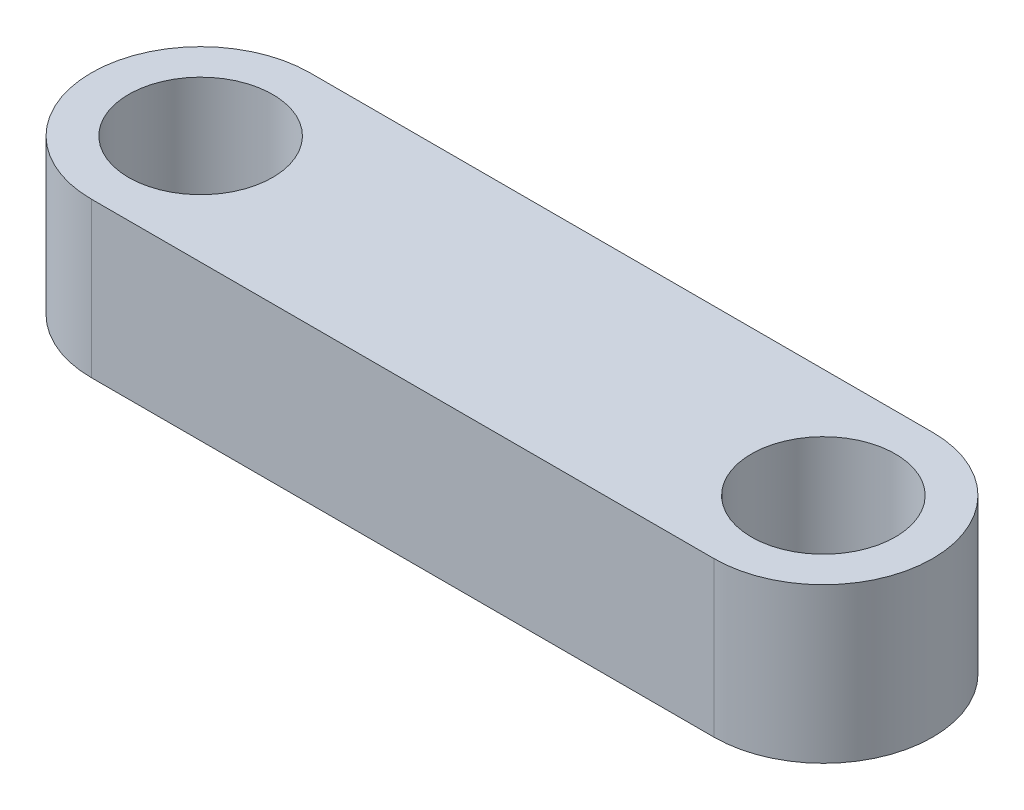
from build123d import *

# Parameters (mm, degrees)
SKETCH1_R           = 2.7
BOSS_EXTRUDE1_DEPTH = 5.8


with BuildPart() as part:
    # Sketch1 → Boss-Extrude1 (new body)
    with BuildSketch(Plane(origin=(0, 0, 0), x_dir=(1, 0, 0), z_dir=(0, 1, 0))):
        with BuildLine():
            Line((-11.675, 4.1), (11.675, 4.1))
            ThreePointArc((11.675, 4.1), (15.775, 0), (11.675, -4.1))
            Line((11.675, -4.1), (-11.675, -4.1))
            ThreePointArc((-11.675, -4.1), (-15.775, 0), (-11.675, 4.1))
        make_face()
        with Locations(Location((-11.675, 0, 0), (0, 0, 270))):
            Circle(SKETCH1_R, mode=Mode.SUBTRACT)
        with Locations(Location((11.675, 0, 0), (0, 0, 270))):
            Circle(SKETCH1_R, mode=Mode.SUBTRACT)
    extrude(amount=BOSS_EXTRUDE1_DEPTH)


solid = part.part
